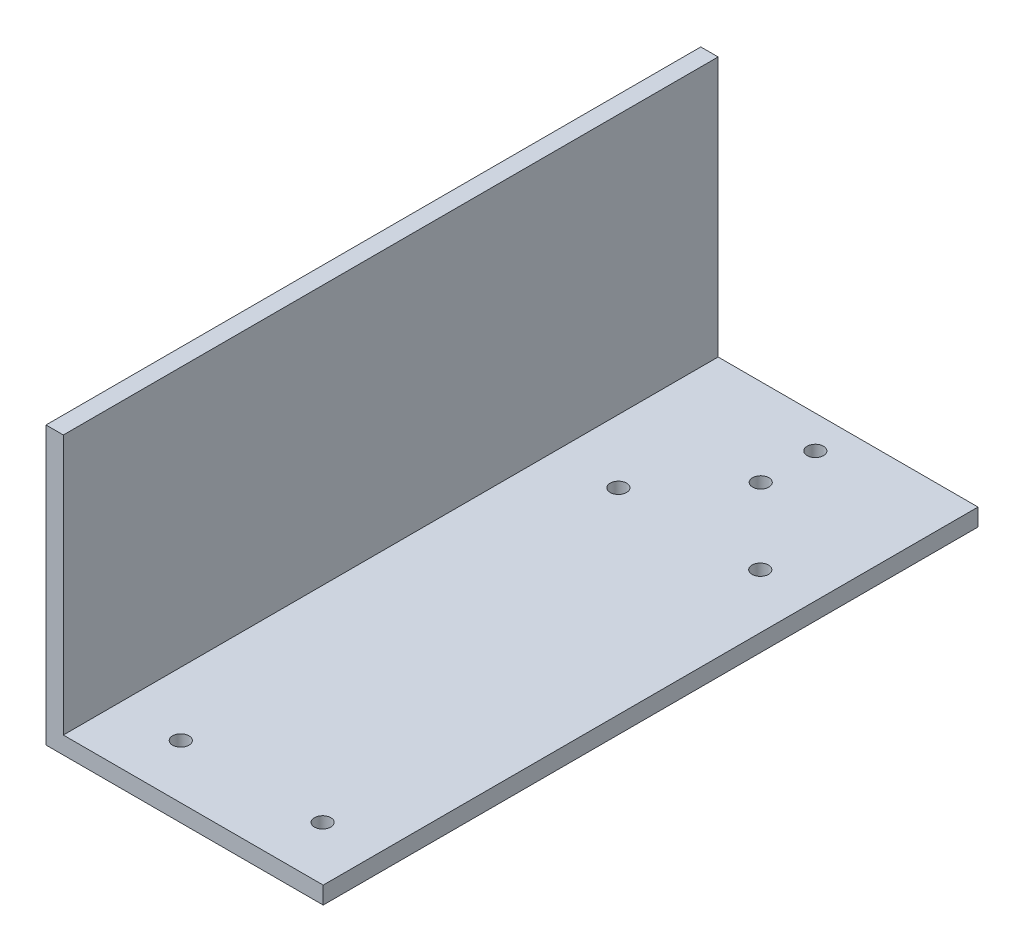
from build123d import *

# Parameters (mm, degrees)
SALIENTE_EXTRUIR1_DEPTH = 120
CROQUIS2_R              = 1.5
CORTAR_EXTRUIR1_DEPTH   = 100
CROQUIS3_R              = 1.5
CORTAR_EXTRUIR2_DEPTH   = 100


with BuildPart() as part:
    # Croquis1 → Saliente-Extruir1 (new body)
    with BuildSketch(Plane.XY):
        Polygon((0, 0), (50.8, 0), (50.8, 3.175), (3.175, 3.175), (3.175, 50.8), (0, 50.8), align=None)
    extrude(amount=SALIENTE_EXTRUIR1_DEPTH)

    # Croquis2 → Cortar-Extruir1 (cut)
    with BuildSketch(Plane(origin=(0, 3.175, 0), x_dir=(1, 0, 0), z_dir=(0, 1, 0))):
        with Locations(Location((40.8, -29.9, 0), (0, 0, 180))):
            Circle(CROQUIS2_R)
        with Locations(Location((14.8, -29.9, 0), (0, 0, 180))):
            Circle(CROQUIS2_R)
        with Locations(Location((40.8, -110.1, 0), (0, 0, 180))):
            Circle(CROQUIS2_R)
        with Locations(Location((14.8, -110.1, 0), (0, 0, 180))):
            Circle(CROQUIS2_R)
    extrude(amount=-CORTAR_EXTRUIR1_DEPTH, mode=Mode.SUBTRACT)

    # Croquis3 → Cortar-Extruir2 (cut)
    with BuildSketch(Plane(origin=(0, 3.175, 0), x_dir=(1, 0, 0), z_dir=(0, 1, 0))):
        with Locations(Location((26.985, -6, 0), (0, 0, 180))):
            Circle(CROQUIS3_R)
        with Locations(Location((26.985, -16, 0), (0, 0, 180))):
            Circle(CROQUIS3_R)
    extrude(amount=-CORTAR_EXTRUIR2_DEPTH, mode=Mode.SUBTRACT)


solid = part.part
